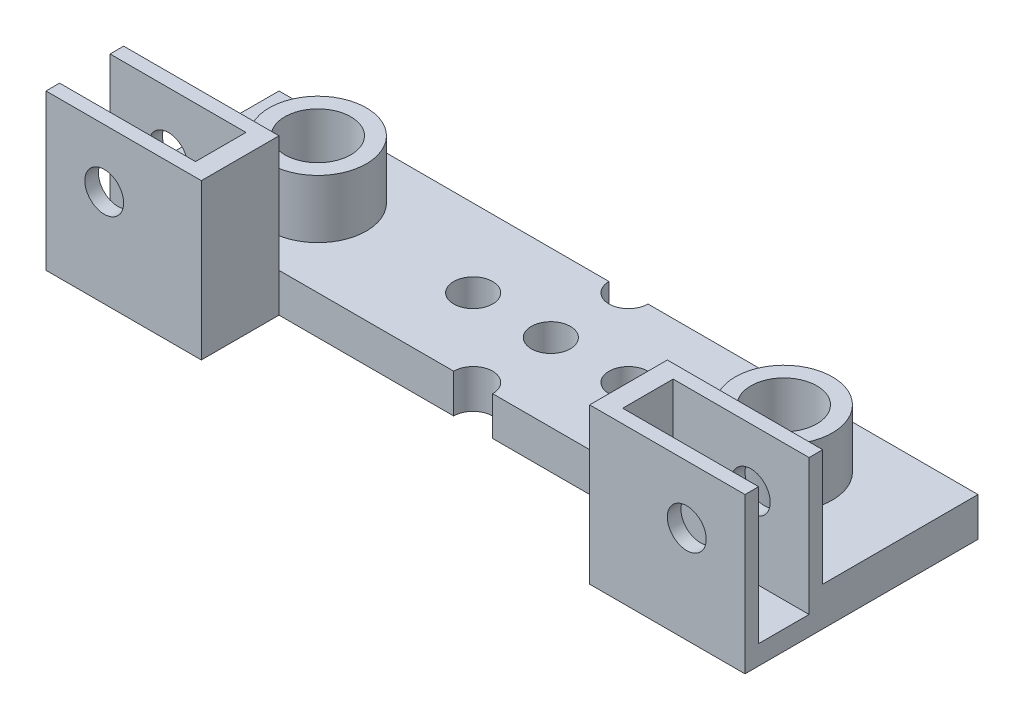
from build123d import *

# Parameters (mm, degrees)
SKETCH1_R           = 2.51
BOSS_EXTRUDE1_DEPTH = 5
SKETCH2_R           = 6.25
SKETCH2_R_2         = 4.25
BOSS_EXTRUDE2_DEPTH = 7.5
SKETCH2_3_R         = 4.25
CUT_EXTRUDE1_DEPTH  = 47.703854396
SKETCH1_3_W         = 20
SKETCH1_3_H         = 10
BOSS_EXTRUDE3_DEPTH = 20
SKETCH3_W           = 17.5
SKETCH3_H           = 6.5
CUT_EXTRUDE2_DEPTH  = 17.5
CUT_EXTRUDE3_REACH  = 59.663
SKETCH4_R           = 2.5


with BuildPart() as part:
    # Sketch1 → Boss-Extrude1 (new body)
    with BuildSketch(Plane(origin=(0, 0, 0), x_dir=(1, 0, 0), z_dir=(0, 1, 0))):
        with BuildLine():
            Line((2.51, -9.999999226), (45, -9.999999226))
            Line((45, -9.999999226), (45, 10.000000774))
            Line((45, 10.000000774), (2.51, 10.000000774))
            ThreePointArc((2.51, 10.000000774), (0, 7.490000774), (-2.51, 10.000000774))
            Line((-2.51, 10.000000774), (-45, 10.000000774))
            Line((-45, 10.000000774), (-45, -9.999999226))
            Line((-45, -9.999999226), (-2.51, -9.999999226))
            ThreePointArc((-2.51, -9.999999226), (0, -7.489999226), (2.51, -9.999999226))
        make_face()
        with Locations(Location((-10, 7.74e-07, 0), (0, 0, 270))):
            Circle(SKETCH1_R, mode=Mode.SUBTRACT)
        with Locations(Location((0, 7.74e-07, 0), (0, 0, 270))):
            Circle(SKETCH1_R, mode=Mode.SUBTRACT)
        with Locations(Location((10, 7.74e-07, 0), (0, 0, 270))):
            Circle(SKETCH1_R, mode=Mode.SUBTRACT)
    extrude(amount=BOSS_EXTRUDE1_DEPTH)

    # Sketch2 → Boss-Extrude2 (add)
    # profile 1 of 2: a face of its own
    with BuildSketch(Plane(origin=(0, 5, 0), x_dir=(1, 0, 0), z_dir=(0, 1, 0))):
        with Locations(Location((-30, 0, 0), (0, 0, 270))):
            Circle(SKETCH2_R)
        with Locations(Location((-30, 0, 0), (0, 0, 270))):
            Circle(SKETCH2_R_2, mode=Mode.SUBTRACT)
    # profile 2 of 2: a face of its own
    with BuildSketch(Plane(origin=(0, 5, 0), x_dir=(1, 0, 0), z_dir=(0, 1, 0))):
        with Locations(Location((30, 0, 0), (0, 0, 270))):
            Circle(SKETCH2_R)
        with Locations(Location((30, 0, 0), (0, 0, 270))):
            Circle(SKETCH2_R_2, mode=Mode.SUBTRACT)
    extrude(amount=BOSS_EXTRUDE2_DEPTH)

    # Sketch2<3> → Cut-Extrude1 (cut, through all)
    with BuildSketch(Plane(origin=(0, 5, 0), x_dir=(1, 0, 0), z_dir=(0, 1, 0))):
        with Locations(Location((-30, 0, 0), (0, 0, 270))):
            Circle(SKETCH2_3_R)
        with Locations(Location((30, 0, 0), (0, 0, 270))):
            Circle(SKETCH2_3_R)
    extrude(amount=-CUT_EXTRUDE1_DEPTH, mode=Mode.SUBTRACT)

    # Sketch1<3> → Boss-Extrude3 (add)
    with BuildSketch(Plane(origin=(0, 0, 0), x_dir=(1, 0, 0), z_dir=(0, 1, 0))):
        with Locations((35, -14.999999226)):
            Rectangle(SKETCH1_3_W, SKETCH1_3_H)
        with Locations((-35, -14.999999226)):
            Rectangle(SKETCH1_3_W, SKETCH1_3_H)
    extrude(amount=BOSS_EXTRUDE3_DEPTH)

    # Sketch3 → Cut-Extrude2 (cut)
    with BuildSketch(Plane(origin=(0, 20, 0), x_dir=(1, 0, 0), z_dir=(0, 1, 0))):
        with Locations((36.25, -14.999999226)):
            Rectangle(SKETCH3_W, SKETCH3_H)
        with Locations((-36.25, -14.999999226)):
            Rectangle(SKETCH3_W, SKETCH3_H)
    extrude(amount=-CUT_EXTRUDE2_DEPTH, mode=Mode.SUBTRACT)

    # Cut-Extrude3: up to this face of the body (flat: up to its plane)
    cut_extrude3_end = Plane(part.part.faces().sort_by_distance((35, 12.5, 9.999999226))[0])
    # Sketch4 → Cut-Extrude3 (cut, up to the picked face)
    with BuildSketch(Plane.XY.offset(19.999999226), mode=Mode.PRIVATE) as cut_extrude3_sk1:
        with Locations((37.5, 12.5)):
            Circle(SKETCH4_R)
    cut_extrude3_tool1 = split(extrude(cut_extrude3_sk1.sketch, amount=-CUT_EXTRUDE3_REACH, mode=Mode.PRIVATE), bisect_by=cut_extrude3_end, keep=Keep.BOTH, mode=Mode.PRIVATE)
    # Sketch4 → Cut-Extrude3 (cut, up to the picked face)
    with BuildSketch(Plane.XY.offset(19.999999226), mode=Mode.PRIVATE) as cut_extrude3_sk2:
        with Locations((-37.5, 12.5)):
            Circle(SKETCH4_R)
    cut_extrude3_tool2 = split(extrude(cut_extrude3_sk2.sketch, amount=-CUT_EXTRUDE3_REACH, mode=Mode.PRIVATE), bisect_by=cut_extrude3_end, keep=Keep.BOTH, mode=Mode.PRIVATE)
    add(cut_extrude3_tool1.solids().sort_by(Axis((37.5, 12.5, 19.999999), (0, 0, -1)))[0], mode=Mode.SUBTRACT)
    add(cut_extrude3_tool2.solids().sort_by(Axis((-37.5, 12.5, 19.999999), (0, 0, -1)))[0], mode=Mode.SUBTRACT)


solid = part.part
